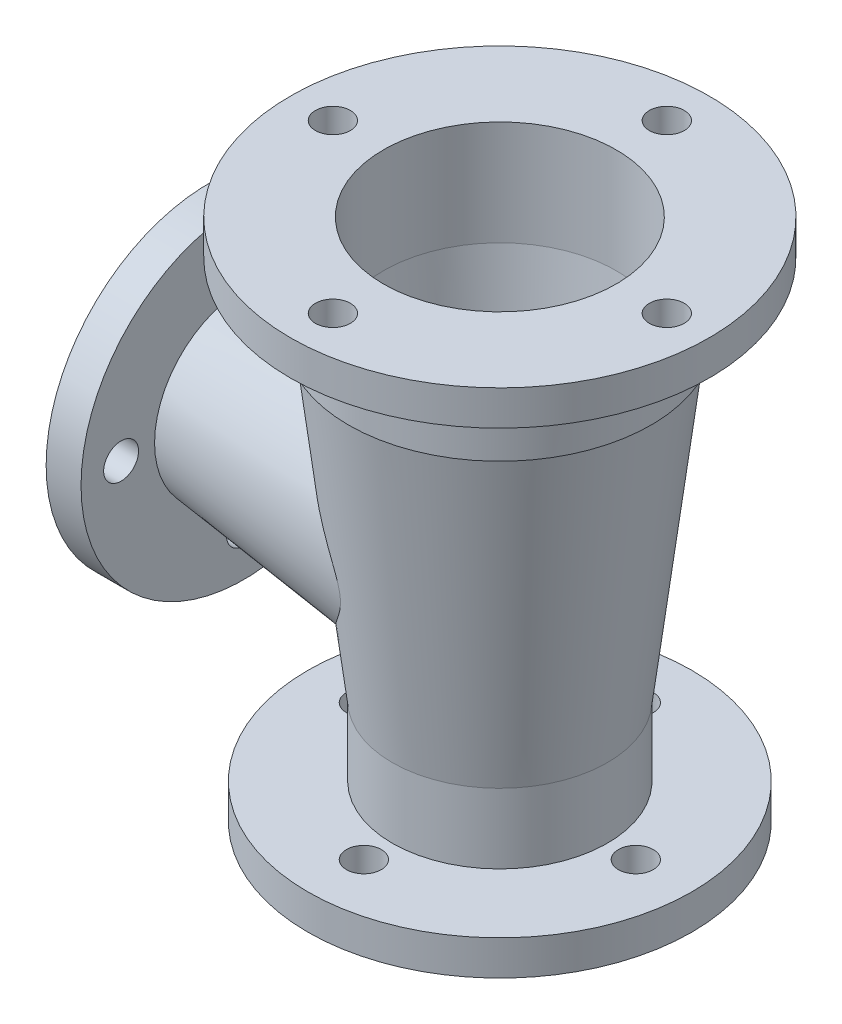
from build123d import *

# Parameters (mm, degrees)
CUT_EXTRUDE1_DEPTH      = 260.167899247
CUT_EXTRUDE1_DEPTH_BACK = 12
SKETCH9_R               = 6
SKETCH10_R              = 6
CUT_EXTRUDE2_DEPTH      = 12
SKETCH11_R              = 6
CUT_EXTRUDE3_DEPTH      = 12


with BuildPart() as part:
    # Sketch2 → Revolve1 (revolve)
    with BuildSketch(Plane.XY, mode=Mode.PRIVATE) as revolve1_sk:
        Polygon((20, 0), (66, 0), (66, 12), (37, 12), (37, 36), (50, 144), (52, 144), (52, 168), (72, 168), (72, 180), (40, 180), (40, 144), (27, 36), (20, 36), align=None)
    revolve(revolve1_sk.sketch.rotate(Axis((0, 219.689881735, 0), (0, -1, 0)), 90), axis=Axis((0, 219.689881735, 0), (0, -1, 0)))

    # Sketch3 → Revolve2 (revolve)
    with BuildSketch(Plane.XY, mode=Mode.PRIVATE) as revolve2_sk:
        Polygon((0, 42.72), (0, 52), (-100, 64), (-100, 28), (-88, 28), (-88, 53.28), align=None)
    revolve(revolve2_sk.sketch.rotate(Axis((-132.487962293, 84, 0), (1, 0, 0)), 38.884797464), axis=Axis((-132.487962293, 84, 0), (1, 0, 0)))

    # Sketch9 → Cut-Extrude1 (cut, two sides: drawn at the far end of the back side and taken through both)
    with BuildSketch(Plane.ZY.offset(100).offset(-CUT_EXTRUDE1_DEPTH_BACK)):
        with Locations((0, 123.805824454)):
            Circle(SKETCH9_R)
        with Locations((-38.894430599, 83.612994593)):
            Circle(SKETCH9_R)
        with Locations((0, 44.0513497)):
            Circle(SKETCH9_R)
        with Locations((42.224472522, 84.429003597)):
            Circle(SKETCH9_R)
    extrude(amount=CUT_EXTRUDE1_DEPTH + CUT_EXTRUDE1_DEPTH_BACK, mode=Mode.SUBTRACT)

    # Sketch10 → Cut-Extrude2 (cut)
    with BuildSketch(Plane.XZ):
        with Locations(Location((0, 46.750062071, 0), (0, 0, 270))):
            Circle(SKETCH10_R)
        with Locations(Location((46.750062071, 0, 0), (0, 0, 270))):
            Circle(SKETCH10_R)
        with Locations(Location((0, -46.750062071, 0), (0, 0, 270))):
            Circle(SKETCH10_R)
        with Locations(Location((-46.750062071, 0, 0), (0, 0, 270))):
            Circle(SKETCH10_R)
    extrude(amount=-CUT_EXTRUDE2_DEPTH, mode=Mode.SUBTRACT)

    # Sketch11 → Cut-Extrude3 (cut)
    with BuildSketch(Plane(origin=(0, 180, 0), x_dir=(1, 0, 0), z_dir=(0, 1, 0))):
        with Locations(Location((0, 57.407065467, 0), (0, 0, 270))):
            Circle(SKETCH11_R)
        with Locations(Location((57.407065467, 0, 0), (0, 0, 270))):
            Circle(SKETCH11_R)
        with Locations(Location((0, -57.407065467, 0), (0, 0, 270))):
            Circle(SKETCH11_R)
        with Locations(Location((-57.407065467, 0, 0), (0, 0, 270))):
            Circle(SKETCH11_R)
    extrude(amount=-CUT_EXTRUDE3_DEPTH, mode=Mode.SUBTRACT)


solid = part.part
